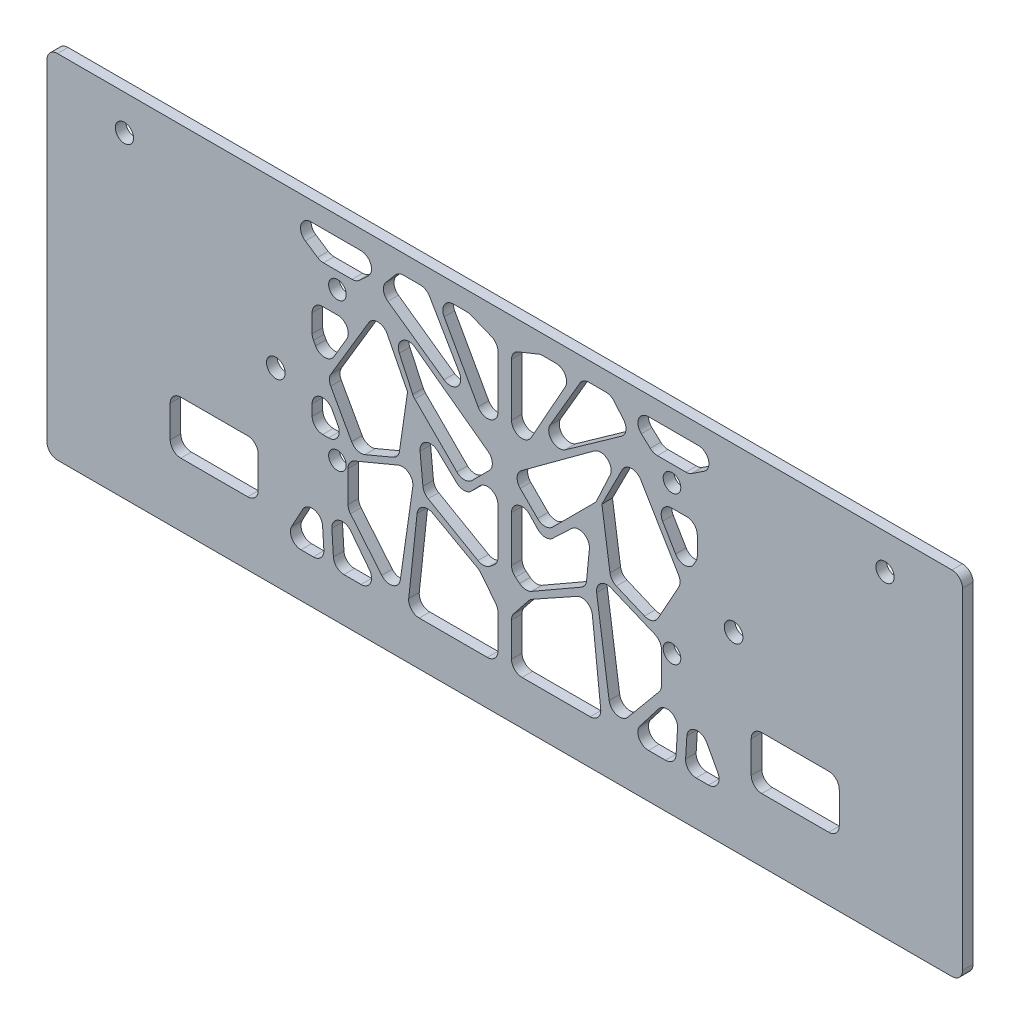
from build123d import *

# Parameters (mm, degrees)
SKETCH_1_W          = 260
SKETCH_1_H          = 100
EXTRUDE_1_DEPTH     = 3
FILLET_1_R          = 3
SKETCH_3_R          = 2.5
SKETCH_3_R_2        = 2.65
CUT_EXTRUDE_1_DEPTH = 3
SKETCH_4_W          = 25
SKETCH_4_H          = 15
CUT_EXTRUDE_2_DEPTH = 3
FILLET_2_R          = 3
SKETCH_5_R          = 2.6
CUT_EXTRUDE_3_DEPTH = 10
CUT_EXTRUDE_4_DEPTH = 10


with BuildPart() as part:
    # 草图1 → 凸台-拉伸1 (new body)
    with BuildSketch(Plane.XY):
        Rectangle(SKETCH_1_W, SKETCH_1_H)
    extrude(amount=EXTRUDE_1_DEPTH)

    # 圆角1
    fillet_1_edges = [part.edges().sort_by_distance(p)[0] for p in [
        (-130, 50, 1.5),
        (130, 50, 1.5),
        (130, -50, 1.5),
        (-130, -50, 1.5),
    ]]
    fillet(fillet_1_edges, radius=FILLET_1_R)

    # 草图3 → 切除-拉伸1 (cut)
    with BuildSketch(Plane(origin=(0, 0, 0), x_dir=(-1, 0, 0), z_dir=(0, 0, -1))):
        with Locations((47.5, 31.7)):
            Circle(SKETCH_3_R)
        with Locations((47.5, -10.3)):
            Circle(SKETCH_3_R)
        with Locations(Location((-47.5, -10.3, 0), (0, 0, 180))):
            Circle(SKETCH_3_R)
        with Locations(Location((-47.5, 31.7, 0), (0, 0, 180))):
            Circle(SKETCH_3_R)
        with Locations((-65, 3.7)):
            Circle(SKETCH_3_R_2)
        with Locations(Location((65, 3.7, 0), (0, 0, 180))):
            Circle(SKETCH_3_R_2)
    extrude(amount=-CUT_EXTRUDE_1_DEPTH, mode=Mode.SUBTRACT)

    # 草图4 → 切除-拉伸2 (cut)
    with BuildSketch(Plane(origin=(0, 0, 0), x_dir=(-1, 0, 0), z_dir=(0, 0, -1))):
        with Locations((82.5, -24.5)):
            Rectangle(SKETCH_4_W, SKETCH_4_H)
        with Locations((-82.5, -24.5)):
            Rectangle(SKETCH_4_W, SKETCH_4_H)
    extrude(amount=-CUT_EXTRUDE_2_DEPTH, mode=Mode.SUBTRACT)

    # 圆角2
    fillet_2_edges = [part.edges().sort_by_distance(p)[0] for p in [
        (95, -32, 1.5),
        (95, -17, 1.5),
        (70, -17, 1.5),
        (70, -32, 1.5),
        (-70, -17, 1.5),
        (-95, -17, 1.5),
        (-95, -32, 1.5),
        (-70, -32, 1.5),
    ]]
    fillet(fillet_2_edges, radius=FILLET_2_R)

    # 草图5 → 切除-拉伸3 (cut)
    with BuildSketch(Plane(origin=(0, 0, 0), x_dir=(-1, 0, 0), z_dir=(0, 0, -1))):
        with Locations((-108, 40)):
            Circle(SKETCH_5_R)
        with Locations(Location((108, 40, 0), (0, 0, 180))):
            Circle(SKETCH_5_R)
    extrude(amount=-CUT_EXTRUDE_3_DEPTH, mode=Mode.SUBTRACT)

    # 草图6 → 切除-拉伸4 (cut)
    with BuildSketch(Plane(origin=(0, 0, 0), x_dir=(-1, 0, 0), z_dir=(0, 0, -1))):
        with BuildLine():
            Line((-38.43643754, -32.636332098), (-43.712742398, -25.802264833))
            ThreePointArc((-43.712742398, -25.802264833), (-47.144176139, -24.827919237), (-49.081503142, -27.823057121))
            Line((-49.081503142, -27.823057121), (-48.653667454, -34.657124386))
            ThreePointArc((-48.653667454, -34.657124386), (-47.713509344, -36.656268679), (-45.659529005, -37.469681209))
            Line((-45.659529005, -37.469681209), (-40.811059834, -37.469681209))
            ThreePointArc((-40.811059834, -37.469681209), (-38.118473036, -35.792547919), (-38.43643754, -32.636332098))
        make_face()
        with BuildLine():
            Line((-51.360791305, -34.282238031), (-51.723195674, -28.493343117))
            ThreePointArc((-51.723195674, -28.493343117), (-54.071849906, -25.751050791), (-57.355476832, -27.252429528))
            Line((-57.355476832, -27.252429528), (-60.489730032, -33.041324442))
            ThreePointArc((-60.489730032, -33.041324442), (-60.428898937, -36.005085015), (-57.851587324, -37.469681209))
            Line((-57.851587324, -37.469681209), (-54.354929755, -37.469681209))
            ThreePointArc((-54.354929755, -37.469681209), (-52.168342284, -36.523661548), (-51.360791305, -34.282238031))
        make_face()
        with BuildLine():
            Line((13.575100139, 3.815637238), (25.530405564, 15.770942663))
            ThreePointArc((25.530405564, 15.770942663), (25.867325361, 16.17265392), (26.129163161, 16.626887174))
            Line((26.129163161, 16.626887174), (29.93321015, 24.804144895))
            ThreePointArc((29.93321015, 24.804144895), (29.114496734, 28.390040701), (25.437622506, 28.487694687))
            Line((25.437622506, 28.487694687), (4.741522721, 13.291878911))
            ThreePointArc((4.741522721, 13.291878911), (3.525699405, 11.101579407), (4.395712081, 8.752384609))
            Line((4.395712081, 8.752384609), (9.332459452, 3.815637238))
            ThreePointArc((9.332459452, 3.815637238), (11.453779795, 2.936957582), (13.575100139, 3.815637238))
        make_face()
        with BuildLine():
            Line((9.389318747, 1.210360133), (7.101238982, 3.622830692))
            ThreePointArc((7.101238982, 3.622830692), (3.813257606, 4.344952194), (1.924544107, 1.558369643))
            Line((1.924544107, 1.558369643), (1.924544107, -11.425741685))
            ThreePointArc((1.924544107, -11.425741685), (2.220338845, -12.724692763), (3.049393375, -13.767495245))
            Line((3.049393375, -13.767495245), (4.228770533, -14.711877258))
            ThreePointArc((4.228770533, -14.711877258), (5.872256912, -15.361165595), (7.596121114, -14.972687744))
            Line((7.596121114, -14.972687744), (21.742112968, -6.861975946))
            ThreePointArc((21.742112968, -6.861975946), (22.769346035, -5.888048687), (23.235657574, -4.551524977))
            Line((23.235657574, -4.551524977), (24.044582036, 3.716648963))
            ThreePointArc((24.044582036, 3.716648963), (22.376389839, 6.703953321), (18.994376532, 6.185456914))
            Line((18.994376532, 6.185456914), (13.63047467, 1.098126307))
            ThreePointArc((13.63047467, 1.098126307), (11.486652322, 0.275871068), (9.389318747, 1.210360133))
        make_face()
        with BuildLine():
            Line((27.260818649, -34.148747769), (24.885997747, -12.076948935))
            ThreePointArc((24.885997747, -12.076948935), (23.282658606, -9.733838219), (20.443817295, -9.776782863))
            Line((20.443817295, -9.776782863), (7.758349182, -16.839896729))
            ThreePointArc((7.758349182, -16.839896729), (7.280919444, -17.169990964), (6.87599185, -17.585845509))
            Line((6.87599185, -17.585845509), (2.582790548, -22.94734486))
            ThreePointArc((2.582790548, -22.94734486), (2.093885113, -23.828830829), (1.924544107, -24.822495592))
            Line((1.924544107, -24.822495592), (1.924544107, -34.469681209))
            ThreePointArc((1.924544107, -34.469681209), (2.803223763, -36.591001552), (4.924544107, -37.469681209))
            Line((4.924544107, -37.469681209), (24.278034425, -37.469681209))
            ThreePointArc((24.278034425, -37.469681209), (26.509939476, -36.474325776), (27.260818649, -34.148747769))
        make_face()
        with BuildLine():
            Line((-1.924544107, -34.469681209), (-1.924544107, -24.822495592))
            ThreePointArc((-1.924544107, -24.822495592), (-2.093885113, -23.828830829), (-2.582790548, -22.94734486))
            Line((-2.582790548, -22.94734486), (-6.87599185, -17.585845509))
            ThreePointArc((-6.87599185, -17.585845509), (-7.280919444, -17.169990964), (-7.758349182, -16.839896729))
            Line((-7.758349182, -16.839896729), (-20.443817295, -9.776782863))
            ThreePointArc((-20.443817295, -9.776782863), (-23.282658606, -9.733838219), (-24.885997747, -12.076948935))
            Line((-24.885997747, -12.076948935), (-27.260818649, -34.148747769))
            ThreePointArc((-27.260818649, -34.148747769), (-26.509939476, -36.474325776), (-24.278034425, -37.469681209))
            Line((-24.278034425, -37.469681209), (-4.924544107, -37.469681209))
            ThreePointArc((-4.924544107, -37.469681209), (-2.803223763, -36.591001552), (-1.924544107, -34.469681209))
        make_face()
        with BuildLine():
            Line((-29.651128128, -30.781689346), (-26.101361406, -6.036502048))
            ThreePointArc((-26.101361406, -6.036502048), (-27.234614801, -3.238199755), (-30.227630385, -2.842451488))
            Line((-30.227630385, -2.842451488), (-42.658638946, -8.036917664))
            ThreePointArc((-42.658638946, -8.036917664), (-43.998969089, -9.142142684), (-44.501970295, -10.804970704))
            Line((-44.501970295, -10.804970704), (-44.501970295, -19.6660767))
            ThreePointArc((-44.501970295, -19.6660767), (-44.323539904, -20.685265075), (-43.809473666, -21.58321733))
            Line((-43.809473666, -21.58321733), (-34.928231828, -32.272832456))
            ThreePointArc((-34.928231828, -32.272832456), (-31.804964987, -33.242650426), (-29.651128128, -30.781689346))
        make_face()
        with BuildLine():
            Line((-13.63047467, 1.098126307), (-18.994376532, 6.185456914))
            ThreePointArc((-18.994376532, 6.185456914), (-22.376389839, 6.703953321), (-24.044582036, 3.716648963))
            Line((-24.044582036, 3.716648963), (-23.235657574, -4.551524977))
            ThreePointArc((-23.235657574, -4.551524977), (-22.769346035, -5.888048687), (-21.742112968, -6.861975946))
            Line((-21.742112968, -6.861975946), (-7.596121114, -14.972687744))
            ThreePointArc((-7.596121114, -14.972687744), (-5.872256912, -15.361165595), (-4.228770533, -14.711877258))
            Line((-4.228770533, -14.711877258), (-3.049393375, -13.767495245))
            ThreePointArc((-3.049393375, -13.767495245), (-2.220338845, -12.724692763), (-1.924544107, -11.425741685))
            Line((-1.924544107, -11.425741685), (-1.924544107, 1.558369643))
            ThreePointArc((-1.924544107, 1.558369643), (-3.813257606, 4.344952194), (-7.101238982, 3.622830692))
            Line((-7.101238982, 3.622830692), (-9.389318747, 1.210360133))
            ThreePointArc((-9.389318747, 1.210360133), (-11.486652322, 0.275871068), (-13.63047467, 1.098126307))
        make_face()
        with BuildLine():
            Line((-4.741522721, 13.291878911), (-25.437622506, 28.487694687))
            ThreePointArc((-25.437622506, 28.487694687), (-29.114496734, 28.390040701), (-29.93321015, 24.804144895))
            Line((-29.93321015, 24.804144895), (-26.129163161, 16.626887174))
            ThreePointArc((-26.129163161, 16.626887174), (-25.867325361, 16.17265392), (-25.530405564, 15.770942663))
            Line((-25.530405564, 15.770942663), (-13.575100139, 3.815637238))
            ThreePointArc((-13.575100139, 3.815637238), (-11.453779795, 2.936957582), (-9.332459452, 3.815637238))
            Line((-9.332459452, 3.815637238), (-4.395712081, 8.752384609))
            ThreePointArc((-4.395712081, 8.752384609), (-3.525699405, 11.101579407), (-4.741522721, 13.291878911))
        make_face()
        with BuildLine():
            Line((-29.898134486, 0.70814244), (-27.595417556, 16.487294778))
            Line((-27.595417556, 16.487294778), (-33.368539059, 27.837925907))
            ThreePointArc((-33.368539059, 27.837925907), (-35.942551994, 29.476216985), (-38.619992685, 28.013052063))
            Line((-38.619992685, 28.013052063), (-49.362258988, 9.977456788))
            ThreePointArc((-49.362258988, 9.977456788), (-49.784462933, 8.48772956), (-49.407577436, 6.985897111))
            Line((-49.407577436, 6.985897111), (-43.483400844, -3.682770048))
            ThreePointArc((-43.483400844, -3.682770048), (-41.84011006, -5.061977363), (-39.695911539, -4.99105403))
            Line((-39.695911539, -4.99105403), (-31.701971714, -1.623319219))
            ThreePointArc((-31.701971714, -1.623319219), (-30.493945592, -0.694421843), (-29.898134486, 0.70814244))
        make_face()
        with BuildLine():
            Line((-54.306354303, 15.80795349), (-53.719611494, 14.751306436))
            ThreePointArc((-53.719611494, 14.751306436), (-51.135393582, 13.207945516), (-48.512365611, 14.684383596))
            Line((-48.512365611, 14.684383596), (-44.842690284, 20.910404591))
            ThreePointArc((-44.842690284, 20.910404591), (-44.822368088, 23.922016037), (-47.427165833, 25.433718786))
            Line((-47.427165833, 25.433718786), (-51.68358397, 25.433718786))
            ThreePointArc((-51.68358397, 25.433718786), (-53.804904313, 24.555039129), (-54.68358397, 22.433718786))
            Line((-54.68358397, 22.433718786), (-54.68358397, 17.264344845))
            ThreePointArc((-54.68358397, 17.264344845), (-54.587745725, 16.512118483), (-54.306354303, 15.80795349))
        make_face()
        with BuildLine():
            Line((-40.836521779, 44.604858366), (-54.986121061, 44.604858366))
            ThreePointArc((-54.986121061, 44.604858366), (-57.859409147, 42.467537666), (-56.638605163, 39.101002082))
            Line((-56.638605163, 39.101002082), (-53.128337157, 36.78431078))
            ThreePointArc((-53.128337157, 36.78431078), (-52.338532354, 36.414878978), (-51.475853055, 36.288167064))
            Line((-51.475853055, 36.288167064), (-43.348717953, 36.288167064))
            ThreePointArc((-43.348717953, 36.288167064), (-42.256975176, 36.493869709), (-41.31494865, 37.082768591))
            Line((-41.31494865, 37.082768591), (-38.802752476, 39.399459893))
            ThreePointArc((-38.802752476, 39.399459893), (-38.042224423, 42.696601143), (-40.836521779, 44.604858366))
        make_face()
        with BuildLine():
            Line((-12.901832298, 28.625515057), (-21.351764836, 43.116084502))
            ThreePointArc((-21.351764836, 43.116084502), (-22.448950825, 44.206173265), (-23.943327215, 44.604858366))
            Line((-23.943327215, 44.604858366), (-28.749878569, 44.604858366))
            ThreePointArc((-28.749878569, 44.604858366), (-30.013035006, 44.325967665), (-31.041336387, 43.541148909))
            Line((-31.041336387, 43.541148909), (-33.728113254, 40.36154558))
            ThreePointArc((-33.728113254, 40.36154558), (-34.412841053, 38.048002904), (-33.172528386, 35.978472435))
            Line((-33.172528386, 35.978472435), (-17.229267628, 24.667506319))
            ThreePointArc((-17.229267628, 24.667506319), (-13.468670155, 24.900583744), (-12.901832298, 28.625515057))
        make_face()
        with BuildLine():
            Line((-17.195293229, 40.144562533), (-7.545142527, 22.826722468))
            ThreePointArc((-7.545142527, 22.826722468), (-4.170155368, 21.383417497), (-1.924544107, 24.287018301))
            Line((-1.924544107, 24.287018301), (-1.924544107, 39.250246166))
            ThreePointArc((-1.924544107, 39.250246166), (-2.437359164, 40.927717792), (-3.800484812, 42.031700947))
            Line((-3.800484812, 42.031700947), (-9.62690998, 44.386313148))
            ThreePointArc((-9.62690998, 44.386313148), (-10.178415498, 44.549715268), (-10.750969275, 44.604858366))
            Line((-10.750969275, 44.604858366), (-14.574694809, 44.604858366))
            ThreePointArc((-14.574694809, 44.604858366), (-17.161284021, 43.124580792), (-17.195293229, 40.144562533))
        make_face()
        with BuildLine():
            Line((9.62690998, 44.386313148), (3.800484812, 42.031700947))
            ThreePointArc((3.800484812, 42.031700947), (2.437359164, 40.927717792), (1.924544107, 39.250246166))
            Line((1.924544107, 39.250246166), (1.924544107, 24.287018301))
            ThreePointArc((1.924544107, 24.287018301), (4.170155368, 21.383417497), (7.545142527, 22.826722468))
            Line((7.545142527, 22.826722468), (17.195293229, 40.144562533))
            ThreePointArc((17.195293229, 40.144562533), (17.161284021, 43.124580792), (14.574694809, 44.604858366))
            Line((14.574694809, 44.604858366), (10.750969275, 44.604858366))
            ThreePointArc((10.750969275, 44.604858366), (10.178415498, 44.549715268), (9.62690998, 44.386313148))
        make_face()
        with BuildLine():
            Line((17.229267628, 24.667506319), (33.172528386, 35.978472435))
            ThreePointArc((33.172528386, 35.978472435), (34.412841053, 38.048002904), (33.728113254, 40.36154558))
            Line((33.728113254, 40.36154558), (31.041336387, 43.541148909))
            ThreePointArc((31.041336387, 43.541148909), (30.013035006, 44.325967665), (28.749878569, 44.604858366))
            Line((28.749878569, 44.604858366), (23.943327215, 44.604858366))
            ThreePointArc((23.943327215, 44.604858366), (22.448950825, 44.206173265), (21.351764836, 43.116084502))
            Line((21.351764836, 43.116084502), (12.901832298, 28.625515057))
            ThreePointArc((12.901832298, 28.625515057), (13.468670155, 24.900583744), (17.229267628, 24.667506319))
        make_face()
        with BuildLine():
            Line((43.348717953, 36.288167064), (51.475853055, 36.288167064))
            ThreePointArc((51.475853055, 36.288167064), (52.338532354, 36.414878978), (53.128337157, 36.78431078))
            Line((53.128337157, 36.78431078), (56.638605163, 39.101002082))
            ThreePointArc((56.638605163, 39.101002082), (57.859409147, 42.467537666), (54.986121061, 44.604858366))
            Line((54.986121061, 44.604858366), (40.836521779, 44.604858366))
            ThreePointArc((40.836521779, 44.604858366), (38.042224423, 42.696601143), (38.802752476, 39.399459893))
            Line((38.802752476, 39.399459893), (41.31494865, 37.082768591))
            ThreePointArc((41.31494865, 37.082768591), (42.256975176, 36.493869709), (43.348717953, 36.288167064))
        make_face()
        with BuildLine():
            Line((51.68358397, 25.433718786), (47.427165833, 25.433718786))
            ThreePointArc((47.427165833, 25.433718786), (44.822368088, 23.922016037), (44.842690284, 20.910404591))
            Line((44.842690284, 20.910404591), (48.512365611, 14.684383596))
            ThreePointArc((48.512365611, 14.684383596), (51.135393582, 13.207945516), (53.719611494, 14.751306436))
            Line((53.719611494, 14.751306436), (54.306354303, 15.80795349))
            ThreePointArc((54.306354303, 15.80795349), (54.587745725, 16.512118483), (54.68358397, 17.264344845))
            Line((54.68358397, 17.264344845), (54.68358397, 22.433718786))
            ThreePointArc((54.68358397, 22.433718786), (53.804904313, 24.555039129), (51.68358397, 25.433718786))
        make_face()
        with BuildLine():
            Line((49.052332767, 1.485310093), (47.365324191, -1.595123462))
            ThreePointArc((47.365324191, -1.595123462), (47.415583571, -4.565345331), (49.996575394, -6.03613599))
            Line((49.996575394, -6.03613599), (51.68358397, -6.03613599))
            ThreePointArc((51.68358397, -6.03613599), (53.804904313, -5.157456333), (54.68358397, -3.03613599))
            Line((54.68358397, -3.03613599), (54.68358397, 0.044297565))
            ThreePointArc((54.68358397, 0.044297565), (52.427306496, 2.95064868), (49.052332767, 1.485310093))
        make_face()
        with BuildLine():
            Line((43.483400844, -3.682770048), (49.407577436, 6.985897111))
            ThreePointArc((49.407577436, 6.985897111), (49.784462933, 8.48772956), (49.362258988, 9.977456788))
            Line((49.362258988, 9.977456788), (38.619992685, 28.013052063))
            ThreePointArc((38.619992685, 28.013052063), (35.942551994, 29.476216985), (33.368539059, 27.837925907))
            Line((33.368539059, 27.837925907), (27.595417556, 16.487294778))
            Line((27.595417556, 16.487294778), (29.898134486, 0.70814244))
            ThreePointArc((29.898134486, 0.70814244), (30.493945592, -0.694421843), (31.701971714, -1.623319219))
            Line((31.701971714, -1.623319219), (39.695911539, -4.99105403))
            ThreePointArc((39.695911539, -4.99105403), (41.84011006, -5.061977363), (43.483400844, -3.682770048))
        make_face()
        with BuildLine():
            Line((60.489730032, -33.041324442), (57.355476832, -27.252429528))
            ThreePointArc((57.355476832, -27.252429528), (54.071849906, -25.751050791), (51.723195674, -28.493343117))
            Line((51.723195674, -28.493343117), (51.360791305, -34.282238031))
            ThreePointArc((51.360791305, -34.282238031), (52.168342284, -36.523661548), (54.354929755, -37.469681209))
            Line((54.354929755, -37.469681209), (57.851587324, -37.469681209))
            ThreePointArc((57.851587324, -37.469681209), (60.428898937, -36.005085015), (60.489730032, -33.041324442))
        make_face()
        with BuildLine():
            Line((48.653667454, -34.657124386), (49.081503142, -27.823057121))
            ThreePointArc((49.081503142, -27.823057121), (47.144176139, -24.827919237), (43.712742398, -25.802264833))
            Line((43.712742398, -25.802264833), (38.43643754, -32.636332098))
            ThreePointArc((38.43643754, -32.636332098), (38.118473036, -35.792547919), (40.811059834, -37.469681209))
            Line((40.811059834, -37.469681209), (45.659529005, -37.469681209))
            ThreePointArc((45.659529005, -37.469681209), (47.713509344, -36.656268679), (48.653667454, -34.657124386))
        make_face()
        with BuildLine():
            Line((44.501970295, -19.6660767), (44.501970295, -10.804970704))
            ThreePointArc((44.501970295, -10.804970704), (43.998969089, -9.142142684), (42.658638946, -8.036917664))
            Line((42.658638946, -8.036917664), (30.227630385, -2.842451488))
            ThreePointArc((30.227630385, -2.842451488), (27.234614801, -3.238199755), (26.101361406, -6.036502048))
            Line((26.101361406, -6.036502048), (29.651128128, -30.781689346))
            ThreePointArc((29.651128128, -30.781689346), (31.804964987, -33.242650426), (34.928231828, -32.272832456))
            Line((34.928231828, -32.272832456), (43.809473666, -21.58321733))
            ThreePointArc((43.809473666, -21.58321733), (44.323539904, -20.685265075), (44.501970295, -19.6660767))
        make_face()
    extrude(amount=-CUT_EXTRUDE_4_DEPTH, mode=Mode.SUBTRACT)


solid = part.part
